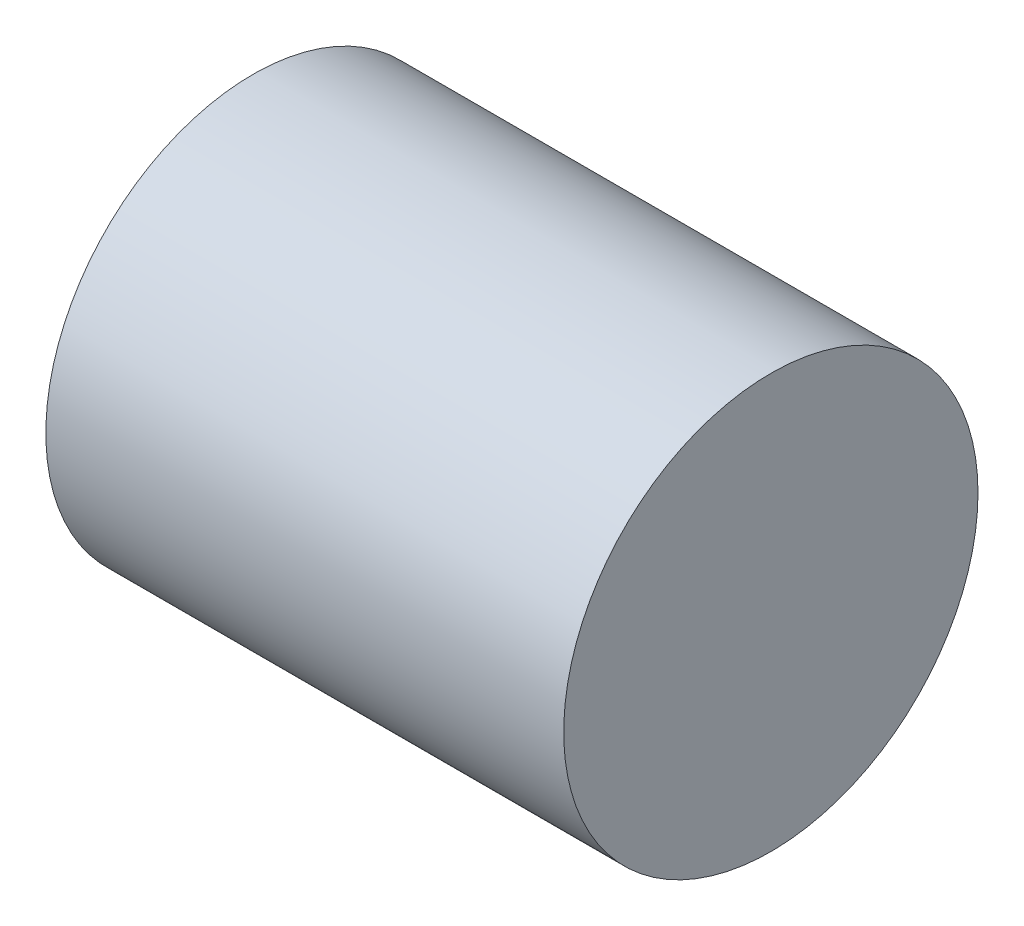
from build123d import *

# Parameters (mm, degrees)
SKIZZE1_R                       = 2
AUFSATZ_LINEAR_AUSTRAGEN1_DEPTH = 5
SKIZZE2_R                       = 1.5
SCHNITT_LINEAR_AUSTRAGEN1_DEPTH = 4


with BuildPart() as part:
    # Skizze1 → Aufsatz-Linear austragen1 (new body)
    with BuildSketch(Plane.YZ):
        with Locations(Location((0, 0, 0), (0, 0, 270))):
            Circle(SKIZZE1_R)
    extrude(amount=AUFSATZ_LINEAR_AUSTRAGEN1_DEPTH)

    # Skizze2 → Schnitt-Linear austragen1 (cut)
    with BuildSketch(Plane(origin=(0, 0, 0), x_dir=(0, -1, 0), z_dir=(-1, 0, 0))):
        with Locations(Location((0, 0, 0), (0, 0, 90))):
            Circle(SKIZZE2_R)
    extrude(amount=-SCHNITT_LINEAR_AUSTRAGEN1_DEPTH, mode=Mode.SUBTRACT)


solid = part.part
